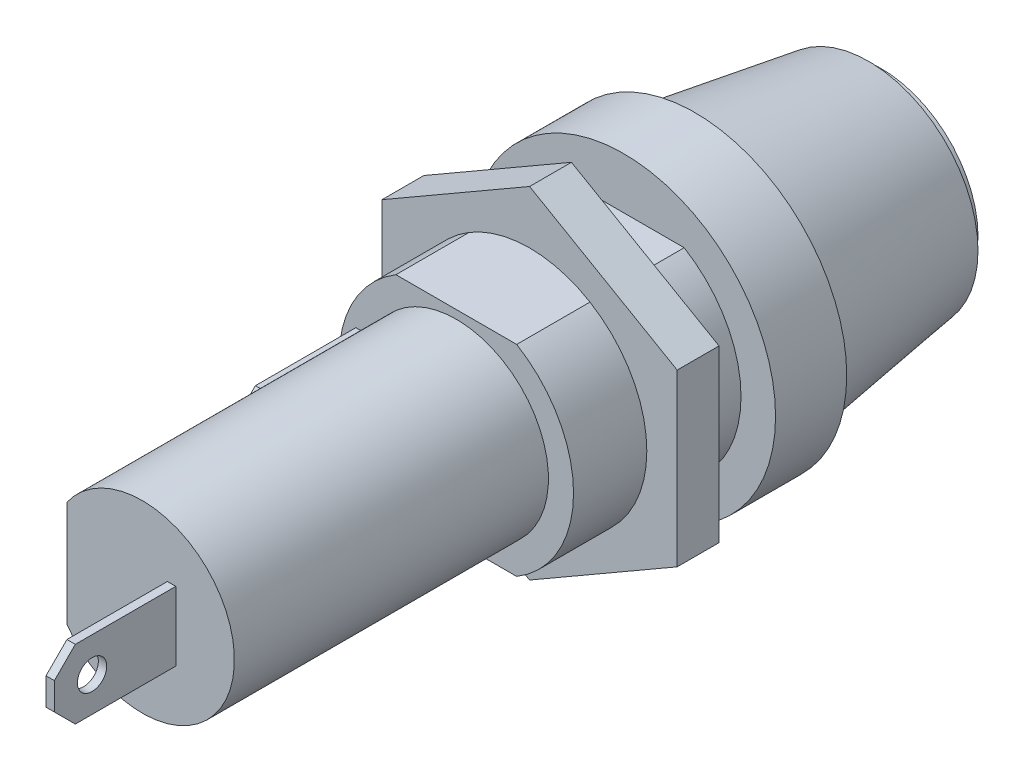
from build123d import *

# Parameters (mm, degrees)
SKETCH1_R               = 9.2075
BOSS_EXTRUDE1_DEPTH     = 4.318
SKETCH3_R               = 7.112
BOSS_EXTRUDE2_DEPTH     = 10.16
SKETCH4_R               = 5.588
BOSS_EXTRUDE3_DEPTH     = 19.05
CUT_EXTRUDE1_DEPTH      = 36.96780361
CUT_EXTRUDE1_DEPTH_BACK = 36.96780361
SKETCH6_W               = 10.16
SKETCH6_H               = 3.476104452
SKETCH6_H_2             = 4.349596252
SKETCH7_W               = 2.54
SKETCH7_H               = 10.16
CUT_EXTRUDE2_DEPTH      = 19.05
SKETCH5_R               = 7.112
BOSS_EXTRUDE5_DEPTH     = 2.54
SKETCH8_W               = 0.508
SKETCH8_H               = 4.191
BOSS_EXTRUDE6_DEPTH     = 7.366
SKETCH9_W               = 0.508
SKETCH9_H               = 4.191
BOSS_EXTRUDE7_DEPTH     = 7.366
SKETCH10_R              = 0.889
CUT_EXTRUDE3_DEPTH      = 0.508
SKETCH11_R              = 0.889
CUT_EXTRUDE4_DEPTH      = 0.508
CUT_EXTRUDE5_DEPTH      = 0.254


with BuildPart() as part:
    # Sketch1 → Boss-Extrude1 (new body)
    with BuildSketch(Plane.XY):
        Circle(SKETCH1_R)
    extrude(amount=BOSS_EXTRUDE1_DEPTH)

    # Sketch2 → Revolve1 (revolve)
    with BuildSketch(Plane(origin=(0, 0, 0), x_dir=(0, 0, -1), z_dir=(1, 0, 0)), mode=Mode.PRIVATE) as revolve1_sk:
        Polygon((0, 0), (0, 8.4582), (0.508, 8.4582), (0.600894659, 8.142981257), (10.541, 6.6294), (10.541, 5.8674), (11.303, 5.8674), (11.303, 0), align=None)
    revolve(revolve1_sk.sketch.rotate(Axis((0, 0, 0), (0, 0, -1)), 90), axis=Axis((0, 0, 0), (0, 0, -1)))

    # Sketch3 → Boss-Extrude2 (add)
    with BuildSketch(Plane.XY.offset(4.318)):
        Circle(SKETCH3_R)
    extrude(amount=BOSS_EXTRUDE2_DEPTH)

    # Sketch4 → Boss-Extrude3 (add)
    with BuildSketch(Plane.XY.offset(14.478)):
        with Locations(Location((0, 0, 0), (0, 0, 180))):
            Circle(SKETCH4_R)
    extrude(amount=BOSS_EXTRUDE3_DEPTH)

    # Sketch6 → Cut-Extrude1 (cut, two sides: drawn at the far end of the back side and taken through both)
    with BuildSketch(Plane(origin=(0, 0, 0), x_dir=(0, 0, -1), z_dir=(1, 0, 0)).offset(-CUT_EXTRUDE1_DEPTH_BACK)):
        with Locations((-9.398, 7.834052226)):
            Rectangle(SKETCH6_W, SKETCH6_H)
        with Locations((-9.398, -8.270798126)):
            Rectangle(SKETCH6_W, SKETCH6_H_2)
    extrude(amount=CUT_EXTRUDE1_DEPTH + CUT_EXTRUDE1_DEPTH_BACK, mode=Mode.SUBTRACT)

    # Sketch7 → Cut-Extrude2 (cut)
    with BuildSketch(Plane.XY.offset(33.528)):
        with Locations((-5.842, 0)):
            Rectangle(SKETCH7_W, SKETCH7_H)
    extrude(amount=-CUT_EXTRUDE2_DEPTH, mode=Mode.SUBTRACT)

    # Sketch5 → Boss-Extrude5 (add)
    with BuildSketch(Plane.XY.offset(7.493)):
        Polygon((8.9535, 5.169305635), (0, 10.33861127), (-8.9535, 5.169305635), (-8.9535, -5.169305635), (0, -10.33861127), (8.9535, -5.169305635), align=None)
        Circle(SKETCH5_R, mode=Mode.SUBTRACT)
    extrude(amount=BOSS_EXTRUDE5_DEPTH)

    # Sketch8 → Boss-Extrude6 (add)
    with BuildSketch(Plane.XY.offset(33.528)):
        with Locations((1.778, 0)):
            Rectangle(SKETCH8_W, SKETCH8_H)
    extrude(amount=BOSS_EXTRUDE6_DEPTH)

    # Sketch9 → Boss-Extrude7 (add)
    with BuildSketch(Plane.XY.offset(14.478)):
        with Locations((-5.842, 0)):
            Rectangle(SKETCH9_W, SKETCH9_H)
    extrude(amount=BOSS_EXTRUDE7_DEPTH)

    # Sketch10 → Cut-Extrude3 (cut)
    with BuildSketch(Plane.ZY.offset(-1.524)):
        with Locations((38.608, 0)):
            Circle(SKETCH10_R)
        Polygon((39.624, 2.0955), (40.894, 0.8255), (40.894, 2.0955), align=None)
        Polygon((39.624, -2.0955), (40.894, -0.8255), (40.894, -2.0955), align=None)
    extrude(amount=-CUT_EXTRUDE3_DEPTH, mode=Mode.SUBTRACT)

    # Sketch11 → Cut-Extrude4 (cut)
    with BuildSketch(Plane.ZY.offset(6.096)):
        with Locations((19.558, 0)):
            Circle(SKETCH11_R)
        Polygon((20.574, 2.0955), (21.844, 0.8255), (21.844, 2.0955), align=None)
        Polygon((20.574, -2.0955), (21.844, -0.8255), (21.844, -2.0955), align=None)
    extrude(amount=-CUT_EXTRUDE4_DEPTH, mode=Mode.SUBTRACT)

    # Sketch12 → Cut-Extrude5 (cut)
    with BuildSketch(Plane(origin=(0, 0, -11.303), x_dir=(-1, 0, 0), z_dir=(0, 0, -1))):
        Polygon((-4.57617006, 2.579062257), (-3.029375188, 2.579062257), (-3.029375188, 2.253421231), (-4.291234162, 2.253421231), (-4.291234162, 1.276498154), (-3.029375188, 1.276498154), (-3.029375188, 0.950857129), (-4.291234162, 0.950857129), (-4.291234162, -0.595937743), (-4.57617006, -0.595937743), align=None)
        with BuildLine():
            Line((-2.459503393, 2.579062257), (-2.174567496, 2.579062257))
            Line((-2.174567496, 2.579062257), (-2.174567496, 0.676733531))
            add(Edge.make_bspline(
                [(-2.174567496, 0.676733531), (-2.174609899, 0.649808863), (-2.174690367, 0.598714667), (-2.174152872, 0.525990566), (-2.172647588, 0.461336264), (-2.171698572, 0.404502541), (-2.169587348, 0.355750192), (-2.167865548, 0.314815089), (-2.165651615, 0.281891062), (-2.162990858, 0.262676936), (-2.161847143, 0.254417826)],
                knots=[0, 0, 0, 0, 1.528628734, 2.90083645, 4.128790002, 5.200304208, 6.127813768, 6.898992206, 7.526736466, 8, 8, 8, 8], degree=3))
            add(Edge.make_bspline(
                [(-2.161847143, 0.254417826), (-2.157150448, 0.224621119), (-2.148021701, 0.166706643), (-2.124756772, 0.084239845), (-2.092265182, 0.009916308), (-2.053763279, -0.058583221), (-2.00302441, -0.11935214), (-1.942242632, -0.175333425), (-1.868602799, -0.224293562), (-1.786723535, -0.269061799), (-1.698471927, -0.305043695), (-1.608291707, -0.332251961), (-1.517538433, -0.348833534), (-1.456781483, -0.350753538), (-1.426610765, -0.351706974)],
                knots=[0, 0, 0, 0, 1.035780045, 2.013197591, 2.933192213, 3.817615948, 4.702609284, 5.640816605, 6.646850145, 7.73207398, 8.84249596, 9.914020372, 10.964143139, 12, 12, 12, 12], degree=3))
            add(Edge.make_bspline(
                [(-1.426610765, -0.351706974), (-1.400708443, -0.350732838), (-1.349053405, -0.348790193), (-1.272303286, -0.336760181), (-1.197554616, -0.315078954), (-1.124438285, -0.287102887), (-1.055902749, -0.250139001), (-0.991909769, -0.207439025), (-0.934792486, -0.157354873), (-0.882669874, -0.101928132), (-0.837281039, -0.039389885), (-0.797937218, 0.02889814), (-0.765710124, 0.103963619), (-0.749795641, 0.156717988), (-0.741619779, 0.183819869)],
                knots=[0, 0, 0, 0, 0.994687771, 1.983630487, 2.973142513, 3.978332533, 4.983357753, 5.956394766, 6.925816176, 7.893390482, 8.871859704, 9.88551698, 10.913711441, 12, 12, 12, 12], degree=3))
            add(Edge.make_bspline(
                [(-0.741619779, 0.183819869), (-0.738898237, 0.19502179), (-0.732833544, 0.219984184), (-0.727166582, 0.262185641), (-0.721264234, 0.311978135), (-0.717168874, 0.369719423), (-0.713176338, 0.435216019), (-0.710787765, 0.508809124), (-0.709683742, 0.59023151), (-0.70935474, 0.647052364), (-0.70918288, 0.676733531)],
                knots=[0, 0, 0, 0, 0.558680831, 1.244966039, 2.062412453, 2.990489873, 4.051219941, 5.244515665, 6.560634259, 8, 8, 8, 8], degree=3))
            Line((-0.70918288, 0.676733531), (-0.70918288, 2.579062257))
            Line((-0.70918288, 2.579062257), (-0.424246983, 2.579062257))
            Line((-0.424246983, 2.579062257), (-0.424246983, 0.661469108))
            add(Edge.make_bspline(
                [(-0.424246983, 0.661469108), (-0.424477506, 0.626908436), (-0.424927387, 0.559461182), (-0.428828624, 0.460626735), (-0.435048903, 0.366870816), (-0.443837382, 0.278180823), (-0.455482378, 0.194874121), (-0.468432042, 0.11622051), (-0.484923476, 0.042784581), (-0.504185204, -0.026006255), (-0.52620478, -0.091488828), (-0.554726393, -0.153635928), (-0.586861475, -0.214336848), (-0.624974767, -0.272673489), (-0.667802236, -0.328904148), (-0.716290546, -0.382687809), (-0.768836035, -0.434883944), (-0.826312207, -0.484153654), (-0.887771612, -0.52933724), (-0.953031431, -0.569068075), (-1.021590358, -0.602653785), (-1.093270179, -0.630299802), (-1.168101485, -0.651086617), (-1.246086161, -0.666576223), (-1.327401715, -0.675377592), (-1.382705367, -0.676685629), (-1.410710324, -0.677348)],
                knots=[0, 0, 0, 0, 1.316592851, 2.569410997, 3.76748051, 4.895814652, 5.963796859, 6.97159953, 7.931736103, 8.829262218, 9.692595152, 10.560224239, 11.431080259, 12.30701507, 13.211635791, 14.121146779, 15.063487852, 16.031507147, 17.00238618, 17.966455255, 18.938106653, 19.907068911, 20.888905087, 21.893141452, 22.933117798, 24, 24, 24, 24], degree=3))
            add(Edge.make_bspline(
                [(-1.410710324, -0.677348), (-1.44125301, -0.676636105), (-1.501177651, -0.675239371), (-1.589477183, -0.667235877), (-1.67412649, -0.652160619), (-1.756019607, -0.632965527), (-1.834041601, -0.606491708), (-1.909237797, -0.575559838), (-1.980320314, -0.53757118), (-2.048442324, -0.495304317), (-2.111783353, -0.447747681), (-2.169928854, -0.39591338), (-2.222974823, -0.340631752), (-2.27002714, -0.281304277), (-2.311865371, -0.218392372), (-2.34790635, -0.151718061), (-2.378851936, -0.08130716), (-2.394823608, -0.0323639), (-2.402897824, -0.007621437)],
                knots=[0, 0, 0, 0, 1.13879206, 2.234305948, 3.301075583, 4.341971843, 5.366689343, 6.369221514, 7.369726634, 8.367512178, 9.355451585, 10.318319045, 11.268648973, 12.207971039, 13.137398894, 14.081662264, 15.030215811, 16, 16, 16, 16], degree=3))
            add(Edge.make_bspline(
                [(-2.402897824, -0.007621437), (-2.407594246, 0.00928097), (-2.41778089, 0.045942667), (-2.428689553, 0.106618267), (-2.437859934, 0.176481799), (-2.446482834, 0.255538046), (-2.45157096, 0.343848282), (-2.456031779, 0.441374227), (-2.459534819, 0.548233807), (-2.459514161, 0.622668975), (-2.459503393, 0.661469108)],
                knots=[0, 0, 0, 0, 0.625038921, 1.35572334, 2.194682327, 3.136881307, 4.189498639, 5.346923369, 6.617055217, 8, 8, 8, 8], degree=3))
            Line((-2.459503393, 0.661469108), (-2.459503393, 2.579062257))
        make_face()
        with BuildLine():
            Line((0.064214556, 0.016547233), (0.332613995, 0.177459693))
            add(Edge.make_bspline(
                [(0.332613995, 0.177459693), (0.357576967, 0.135672715), (0.405405059, 0.055610478), (0.485189506, -0.052573601), (0.567860075, -0.144523558), (0.654028971, -0.21970448), (0.743170224, -0.278894542), (0.835865758, -0.320806566), (0.931803201, -0.346946773), (0.997093739, -0.350121851), (1.029689315, -0.351706974)],
                knots=[0, 0, 0, 0, 1.272034388, 2.437168799, 3.508375237, 4.49857839, 5.41946034, 6.295179144, 7.148887113, 8, 8, 8, 8], degree=3))
            add(Edge.make_bspline(
                [(1.029689315, -0.351706974), (1.057526682, -0.350931664), (1.112714326, -0.34939461), (1.193960075, -0.334625597), (1.272864995, -0.311936022), (1.347802831, -0.27944132), (1.417739567, -0.240127123), (1.479068498, -0.192641661), (1.532087472, -0.139477461), (1.575457169, -0.080166052), (1.608731201, -0.016378353), (1.634305434, 0.049095545), (1.648497751, 0.117284175), (1.650635663, 0.163195095), (1.651714556, 0.18636394)],
                knots=[0, 0, 0, 0, 1.095163259, 2.171163733, 3.241058638, 4.321873601, 5.38011039, 6.391990106, 7.366004449, 8.327778327, 9.272591725, 10.192022065, 11.087607919, 12, 12, 12, 12], degree=3))
            add(Edge.make_bspline(
                [(1.651714556, 0.18636394), (1.650377145, 0.212798853), (1.647658385, 0.26653717), (1.624679114, 0.345821141), (1.588530154, 0.424282258), (1.555181185, 0.472815549), (1.5378674, 0.498012577)],
                knots=[0, 0, 0, 0, 0.938893495, 1.908633276, 2.914225137, 4, 4, 4, 4], degree=3))
            add(Edge.make_bspline(
                [(1.5378674, 0.498012577), (1.523651914, 0.51619791), (1.49380828, 0.554375742), (1.442502537, 0.61120392), (1.38229899, 0.669822057), (1.315257908, 0.732468487), (1.238937178, 0.79622956), (1.155727218, 0.864145783), (1.063503575, 0.933634357), (0.998824746, 0.980236613), (0.965451535, 1.004282609)],
                knots=[0, 0, 0, 0, 0.722233717, 1.516239348, 2.393582979, 3.351407094, 4.387010283, 5.505090956, 6.712668013, 8, 8, 8, 8], degree=3))
            add(Edge.make_bspline(
                [(0.965451535, 1.004282609), (0.93204691, 1.028075685), (0.86817981, 1.073566235), (0.778863811, 1.141079692), (0.698994905, 1.202805203), (0.628928083, 1.259323842), (0.568694163, 1.310643276), (0.517818497, 1.356270693), (0.477597092, 1.397440066), (0.455230958, 1.424147569), (0.445189115, 1.436138579)],
                knots=[0, 0, 0, 0, 1.452282411, 2.77665338, 3.964542531, 5.026858415, 5.96415736, 6.766646006, 7.446254459, 8, 8, 8, 8], degree=3))
            add(Edge.make_bspline(
                [(0.445189115, 1.436138579), (0.431153306, 1.454826662), (0.403550004, 1.491579287), (0.367113699, 1.549023979), (0.336144602, 1.607827941), (0.311867343, 1.66814919), (0.291423773, 1.729140875), (0.277673365, 1.791598791), (0.269063312, 1.855242681), (0.268181581, 1.89807207), (0.267740197, 1.919511976)],
                knots=[0, 0, 0, 0, 1.068054152, 2.10047183, 3.106115577, 4.101338837, 5.06977816, 6.043150881, 7.020423561, 8, 8, 8, 8], degree=3))
            add(Edge.make_bspline(
                [(0.267740197, 1.919511976), (0.268924208, 1.953103272), (0.271266922, 2.019567873), (0.291079392, 2.116660126), (0.322351231, 2.209357804), (0.366161593, 2.296743179), (0.422637906, 2.37654089), (0.487993897, 2.449668839), (0.565837174, 2.511144624), (0.651247054, 2.56485842), (0.744733906, 2.606900795), (0.842697082, 2.638615398), (0.945292283, 2.656585225), (1.01478227, 2.659164019), (1.050041879, 2.660472513)],
                knots=[0, 0, 0, 0, 1.005424448, 1.989358655, 2.955360095, 3.929531133, 4.905563448, 5.876582895, 6.856512386, 7.866279853, 8.892233794, 9.918561126, 10.94386622, 12, 12, 12, 12], degree=3))
            add(Edge.make_bspline(
                [(1.050041879, 2.660472513), (1.08745617, 2.659182056), (1.161861254, 2.656615748), (1.271307328, 2.634302273), (1.376681692, 2.597380949), (1.461448082, 2.555481238), (1.527789944, 2.513633454), (1.57838378, 2.47551547), (1.629653182, 2.431632336), (1.682011703, 2.381867163), (1.734572159, 2.325763324), (1.788114862, 2.263705056), (1.84276502, 2.196071609), (1.877922122, 2.147789384), (1.895945325, 2.123037617)],
                knots=[0, 0, 0, 0, 1.286793592, 2.559021753, 3.825965368, 5.121522368, 5.803751409, 6.523245864, 7.299691795, 8.125521123, 9.008227632, 9.944561021, 10.946284179, 12, 12, 12, 12], degree=3))
            Line((1.895945325, 2.123037617), (1.638358185, 1.927780206))
            add(Edge.make_bspline(
                [(1.638358185, 1.927780206), (1.622804375, 1.947817803), (1.592851373, 1.986405532), (1.547376768, 2.040445225), (1.504515494, 2.089808746), (1.462287631, 2.132684969), (1.422923409, 2.171421904), (1.384717235, 2.204586827), (1.34821893, 2.232504688), (1.302211447, 2.262298489), (1.244410374, 2.291831889), (1.171852973, 2.316822838), (1.096028281, 2.331840644), (1.044384972, 2.333826278), (1.018240998, 2.334831488)],
                knots=[0, 0, 0, 0, 1.181633172, 2.275549214, 3.290209073, 4.226197932, 5.078386478, 5.862611352, 6.581680152, 7.217281963, 8.414376989, 9.595101626, 10.782541182, 12, 12, 12, 12], degree=3))
            add(Edge.make_bspline(
                [(1.018240998, 2.334831488), (0.985441867, 2.333732303), (0.922191832, 2.331612628), (0.832393547, 2.308462356), (0.751572629, 2.272011668), (0.682128517, 2.220925938), (0.624309973, 2.160400466), (0.582485735, 2.090751076), (0.557312372, 2.013841325), (0.554240533, 1.960191394), (0.552676094, 1.932868347)],
                knots=[0, 0, 0, 0, 1.14458467, 2.207223713, 3.21896685, 4.227309161, 5.202851033, 6.127160689, 7.046193047, 8, 8, 8, 8], degree=3))
            add(Edge.make_bspline(
                [(0.552676094, 1.932868347), (0.553032716, 1.915858077), (0.553746543, 1.881809722), (0.563702253, 1.831507361), (0.576492358, 1.781332074), (0.596760317, 1.731509446), (0.624741414, 1.681168134), (0.661485395, 1.629441272), (0.707761756, 1.575872936), (0.743210189, 1.541031962), (0.761925894, 1.522636976)],
                knots=[0, 0, 0, 0, 0.858281714, 1.717966888, 2.583508476, 3.4729293, 4.427298488, 5.488583878, 6.674047936, 8, 8, 8, 8], degree=3))
            add(Edge.make_bspline(
                [(0.761925894, 1.522636976), (0.768875853, 1.516434817), (0.785387365, 1.501699907), (0.815573384, 1.477576909), (0.855435779, 1.447820109), (0.903933633, 1.411001615), (0.961961168, 1.368292003), (1.029524766, 1.320237369), (1.105871299, 1.265277702), (1.160047609, 1.226853362), (1.188693722, 1.206536215)],
                knots=[0, 0, 0, 0, 0.420754252, 0.999615792, 1.744751191, 2.668019286, 3.750313428, 4.999500688, 6.413464383, 8, 8, 8, 8], degree=3))
            add(Edge.make_bspline(
                [(1.188693722, 1.206536215), (1.223152372, 1.181461553), (1.289876772, 1.132907946), (1.384816148, 1.059959436), (1.470898388, 0.988614675), (1.548425723, 0.919329274), (1.618164061, 0.85262879), (1.679339708, 0.787710762), (1.732576004, 0.725040278), (1.78988858, 0.644692299), (1.848451745, 0.546012315), (1.898745113, 0.425109913), (1.930457328, 0.303737536), (1.934604345, 0.222161049), (1.936650453, 0.181911816)],
                knots=[0, 0, 0, 0, 1.163667725, 2.253281268, 3.268753668, 4.215851969, 5.092017293, 5.902905408, 6.650798638, 7.335211899, 8.59617414, 9.77448103, 10.901945474, 12, 12, 12, 12], degree=3))
            add(Edge.make_bspline(
                [(1.936650453, 0.181911816), (1.936054335, 0.153447156), (1.934873675, 0.097070601), (1.921301989, 0.01428921), (1.901417721, -0.06611165), (1.87144823, -0.143138159), (1.834869365, -0.21819948), (1.788454269, -0.289326647), (1.734653726, -0.35809388), (1.672937383, -0.422667475), (1.605404314, -0.48194581), (1.534026962, -0.534677173), (1.458688501, -0.578644867), (1.379797628, -0.61452313), (1.297336222, -0.64258425), (1.211332018, -0.662915924), (1.121643247, -0.675394319), (1.06068281, -0.676689502), (1.029689315, -0.677348)],
                knots=[0, 0, 0, 0, 0.983748083, 1.948392443, 2.894712957, 3.844097841, 4.80183111, 5.778335162, 6.776009319, 7.81870978, 8.863265674, 9.881300176, 10.883814829, 11.87499822, 12.874611388, 13.892143829, 14.928324115, 16, 16, 16, 16], degree=3))
            add(Edge.make_bspline(
                [(1.029689315, -0.677348), (1.005708683, -0.676884285), (0.958049429, -0.675962695), (0.887555827, -0.667815391), (0.818486343, -0.656288233), (0.751707673, -0.637987469), (0.686359449, -0.615783354), (0.622725887, -0.588443581), (0.560776145, -0.55568012), (0.500163052, -0.518219633), (0.441040765, -0.474624394), (0.383963819, -0.423848436), (0.327059487, -0.367292157), (0.272007348, -0.303419717), (0.217693853, -0.233263027), (0.165189867, -0.156165697), (0.113408595, -0.072547669), (0.080918849, -0.01370577), (0.064214556, 0.016547233)],
                knots=[0, 0, 0, 0, 0.915332311, 1.819136955, 2.706846663, 3.586547465, 4.459518054, 5.340707479, 6.227863349, 7.133153174, 8.059268498, 9.028702269, 10.047606654, 11.120612155, 12.245963614, 13.433783089, 14.680604001, 16, 16, 16, 16], degree=3))
        make_face()
        Polygon((2.587932504, 2.579062257), (4.378958145, 2.579062257), (4.378958145, 2.253421231), (2.872868402, 2.253421231), (2.872868402, 1.276498154), (4.378958145, 1.276498154), (4.378958145, 0.950857129), (2.872868402, 0.950857129), (2.872868402, -0.270296717), (4.378958145, -0.270296717), (4.378958145, -0.595937743), (2.587932504, -0.595937743), align=None)
    extrude(amount=-CUT_EXTRUDE5_DEPTH, mode=Mode.SUBTRACT)


solid = part.part
